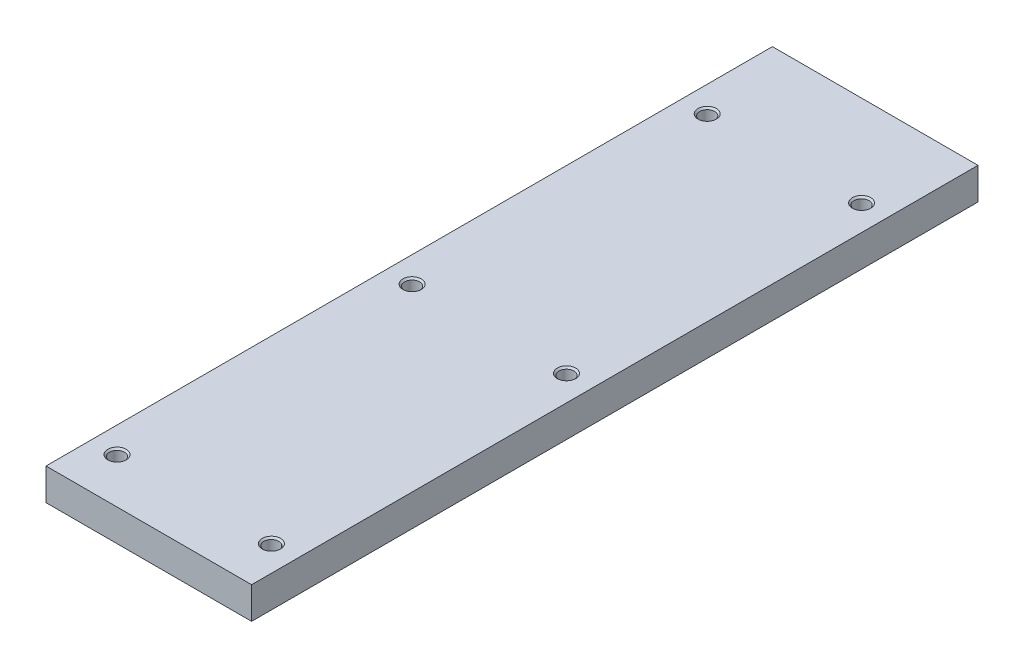
from build123d import *

# Parameters (mm, degrees)
ESQUISSE1_W                 = 45.287967496
ESQUISSE1_H                 = 7
BOSS_EXTRU_1_DEPTH          = 160
TROU_TARAUD_M41_D           = 3.3
TROU_TARAUD_M41_CSINK_D     = 4.05
TROU_TARAUD_M41_CSINK_ANGLE = 90
TROU_TARAUD_M53_D           = 4.2
TROU_TARAUD_M53_DEPTH       = 50
TROU_TARAUD_M53_CSINK_D     = 5.05
TROU_TARAUD_M53_CSINK_ANGLE = 90
TROU_TARAUD_M53_TIP         = 1.2618073


with BuildPart() as part:
    # Esquisse1 → Boss.-Extru.1 (new body)
    with BuildSketch(Plane.XY):
        with Locations((-5.5, -9.47)):
            Rectangle(ESQUISSE1_W, ESQUISSE1_H)
    extrude(amount=BOSS_EXTRU_1_DEPTH)

    # Trou taraudé M41 (through all)
    with Locations(Plane(origin=(0.354832292, -5.97, 0), x_dir=(1, 0, 0), z_dir=(0, 1, 0))):
        with Locations((-22.854832292, -20), (-22.854832292, -85), (-22.854832292, -150), (11.145167708, -150), (11.145167708, -85), (11.145167708, -20)):
            CounterSinkHole(TROU_TARAUD_M41_D / 2, TROU_TARAUD_M41_CSINK_D / 2, counter_sink_angle=TROU_TARAUD_M41_CSINK_ANGLE)

    # Trou taraudé M53
    with Locations(Plane(origin=(0, 0, 0), x_dir=(-1, 0, 0), z_dir=(0, 0, -1))):
        with Locations((5.5, -9.47)):
            CounterSinkHole(TROU_TARAUD_M53_D / 2, TROU_TARAUD_M53_CSINK_D / 2, depth=TROU_TARAUD_M53_DEPTH, counter_sink_angle=TROU_TARAUD_M53_CSINK_ANGLE)
            with Locations((0, 0, -(TROU_TARAUD_M53_DEPTH + TROU_TARAUD_M53_TIP / 2))):  # 118° drill point
                Cone(0, TROU_TARAUD_M53_D / 2, TROU_TARAUD_M53_TIP, mode=Mode.SUBTRACT)


solid = part.part
